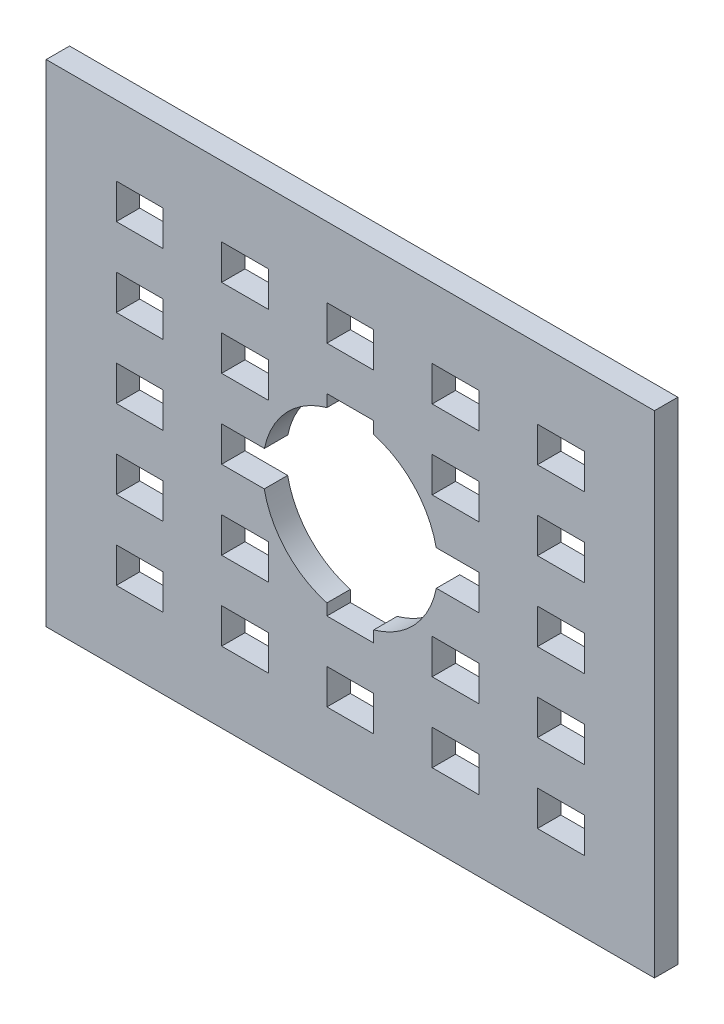
from build123d import *

# Parameters (mm, degrees)
SKETCH1_W           = 26
SKETCH1_H           = 1
BOSS_EXTRUDE1_DEPTH = 21
SKETCH2_W           = 2
SKETCH2_H           = 1.5
CUT_EXTRUDE1_DEPTH  = 1
CUT_EXTRUDE3_REACH  = 26.718
SKETCH3_R           = 3.75


with BuildPart() as part:
    # Sketch1 → Boss-Extrude1 (new body)
    with BuildSketch(Plane(origin=(0, 0, 0), x_dir=(1, 0, 0), z_dir=(0, 1, 0))):
        Rectangle(SKETCH1_W, SKETCH1_H)
    extrude(amount=BOSS_EXTRUDE1_DEPTH)

    # Sketch2 → Cut-Extrude1 (cut)
    with BuildSketch(Plane.XY.offset(0.5)):
        with Locations((-4.5, 17.25)):
            Rectangle(SKETCH2_W, SKETCH2_H)
        with Locations((-9, 17.25)):
            Rectangle(SKETCH2_W, SKETCH2_H)
        with Locations((0, 17.25)):
            Rectangle(SKETCH2_W, SKETCH2_H)
        with Locations((4.5, 17.25)):
            Rectangle(SKETCH2_W, SKETCH2_H)
        with Locations((9, 17.25)):
            Rectangle(SKETCH2_W, SKETCH2_H)
        with Locations((-9, 13.883333)):
            Rectangle(SKETCH2_W, SKETCH2_H)
        with Locations((-4.5, 13.883333)):
            Rectangle(SKETCH2_W, SKETCH2_H)
        with Locations((0, 13.883333)):
            Rectangle(SKETCH2_W, SKETCH2_H)
        with Locations((4.5, 13.883333)):
            Rectangle(SKETCH2_W, SKETCH2_H)
        with Locations((9, 13.883333)):
            Rectangle(SKETCH2_W, SKETCH2_H)
        with Locations((-9, 10.516666)):
            Rectangle(SKETCH2_W, SKETCH2_H)
        with Locations((-4.5, 10.516666)):
            Rectangle(SKETCH2_W, SKETCH2_H)
        with Locations((0, 10.516666)):
            Rectangle(SKETCH2_W, SKETCH2_H)
        with Locations((4.5, 10.516666)):
            Rectangle(SKETCH2_W, SKETCH2_H)
        with Locations((9, 10.516666)):
            Rectangle(SKETCH2_W, SKETCH2_H)
        with Locations((-9, 7.149999)):
            Rectangle(SKETCH2_W, SKETCH2_H)
        with Locations((-4.5, 7.149999)):
            Rectangle(SKETCH2_W, SKETCH2_H)
        with Locations((0, 7.149999)):
            Rectangle(SKETCH2_W, SKETCH2_H)
        with Locations((4.5, 7.149999)):
            Rectangle(SKETCH2_W, SKETCH2_H)
        with Locations((9, 7.149999)):
            Rectangle(SKETCH2_W, SKETCH2_H)
        with Locations((-9, 3.783332)):
            Rectangle(SKETCH2_W, SKETCH2_H)
        with Locations((-4.5, 3.783332)):
            Rectangle(SKETCH2_W, SKETCH2_H)
        with Locations((0, 3.783332)):
            Rectangle(SKETCH2_W, SKETCH2_H)
        with Locations((4.5, 3.783332)):
            Rectangle(SKETCH2_W, SKETCH2_H)
        with Locations((9, 3.783332)):
            Rectangle(SKETCH2_W, SKETCH2_H)
    extrude(amount=-CUT_EXTRUDE1_DEPTH, mode=Mode.SUBTRACT)

    # Sketch3 → Cut-Extrude3 (cut, up to next)
    with BuildSketch(Plane.XY.offset(0.5), mode=Mode.PRIVATE) as cut_extrude3_sk1:
        with Locations((0, 10.5)):
            Circle(SKETCH3_R)
    cut_extrude3_tool1 = extrude(cut_extrude3_sk1.sketch, amount=-CUT_EXTRUDE3_REACH, mode=Mode.PRIVATE) & part.part
    add(cut_extrude3_tool1.solids().sort_by_distance((0, 10.5, 0.5))[0], mode=Mode.SUBTRACT)


solid = part.part
